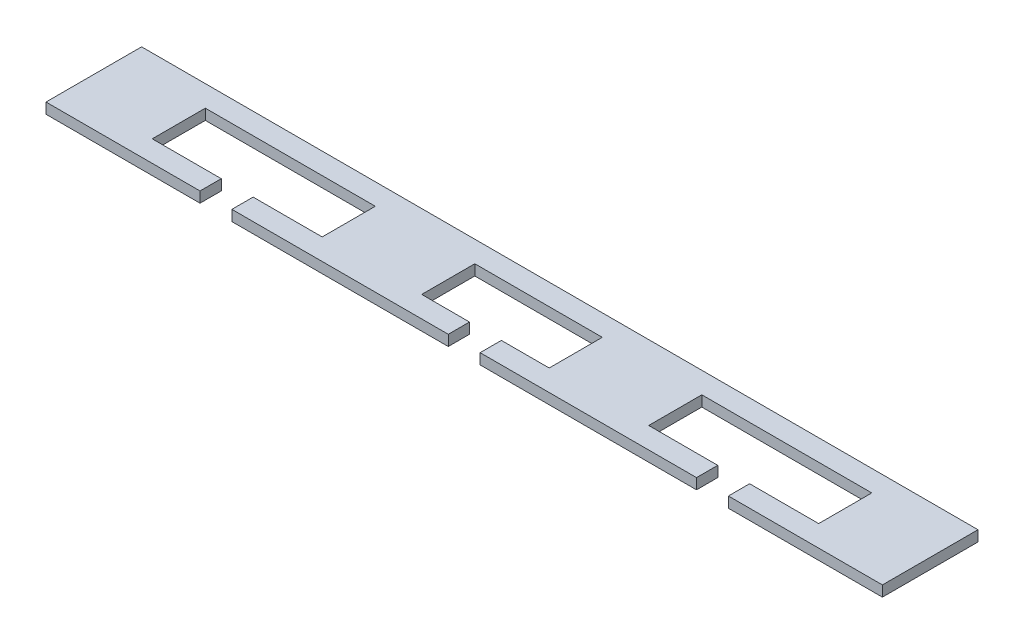
from build123d import *

# Parameters (mm, degrees)
BOSS_EXTRUDE1_DEPTH = 12.7


with BuildPart() as part:
    # Sketch1 → Boss-Extrude1 (new body)
    with BuildSketch(Plane(origin=(0, 0, 0), x_dir=(1, 0, 0), z_dir=(0, 1, 0))):
        Polygon((0, 0), (0, 114.3), (1000.00054, 114.3), (1000.00054, 0), (815.85054, 0), (815.85054, 25.4), (898.40054, 25.4), (898.40054, 88.9), (695.20054, 88.9), (695.20054, 25.4), (777.75054, 25.4), (777.75054, 0), (550.80027, 0), (519.05027, 0), (519.05027, 25.4), (576.20027, 25.4), (576.20027, 88.9), (423.80027, 88.9), (423.80027, 25.4), (480.95027, 25.4), (480.95027, 0), (449.20027, 0), (222.25, 0), (222.25, 25.4), (304.8, 25.4), (304.8, 88.9), (101.6, 88.9), (101.6, 25.4), (184.15, 25.4), (184.15, 0), align=None)
    extrude(amount=BOSS_EXTRUDE1_DEPTH)


solid = part.part
